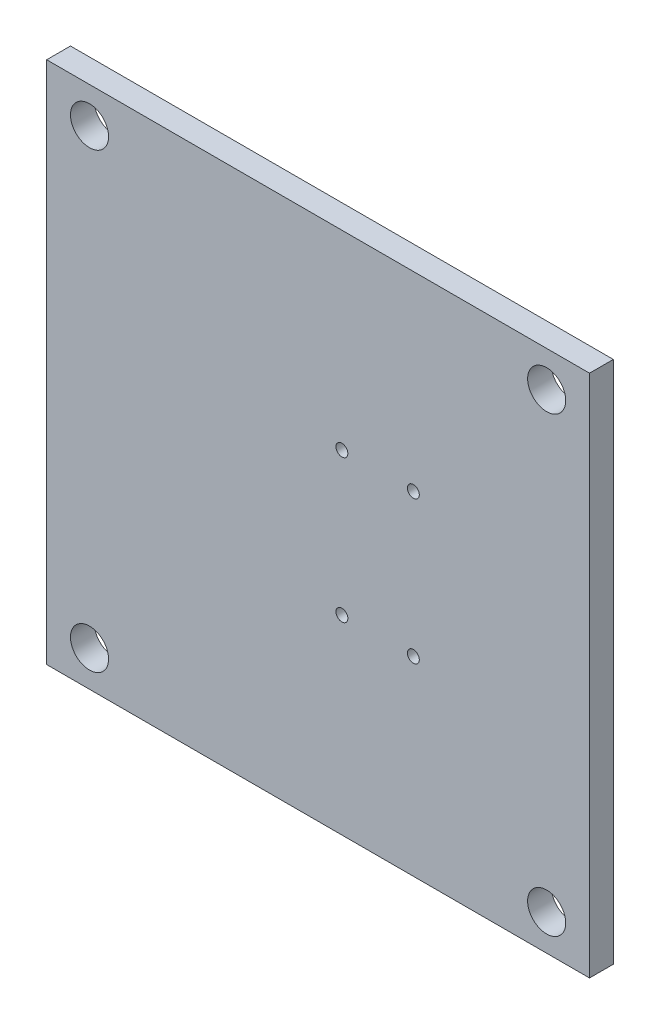
from build123d import *

# Parameters (mm, degrees)
SKETCH_1_W               = 114
SKETCH_1_H               = 110
EXTRUDE_2_DEPTH          = 2.5
SKETCH_2_R               = 4
CUT_EXTRUDE_1_DEPTH      = 80.366239674
MIRROR_2_COPY_1_SKETCH_R = 4
MIRROR_2_COPY_1_DEPTH    = 80.366239674
HOLE_WIZARD_M3_1_D       = 2.5


with BuildPart() as part:
    # 草图1 → 凸台-拉伸2 (new, symmetric)
    with BuildSketch(Plane.XY):
        Rectangle(SKETCH_1_W, SKETCH_1_H)
    extrude(amount=EXTRUDE_2_DEPTH, both=True)

    # 草图2 → 切除-拉伸1 (cut, through all)
    with BuildSketch(Plane.XY.offset(2.5)):
        with Locations((-48, 47.5)):
            Circle(SKETCH_2_R)
    cut_extrude_1 = extrude(amount=-CUT_EXTRUDE_1_DEPTH, mode=Mode.SUBTRACT)

    # 镜向1: 切除-拉伸1 across plane
    add(cut_extrude_1.mirror(Plane.ZX), mode=Mode.SUBTRACT)

    # 镜向2: 切除-拉伸1 across plane
    add(cut_extrude_1.mirror(Plane(origin=(0, 0, 0), x_dir=(0, 0, 1), z_dir=(1, 0, 0))), mode=Mode.SUBTRACT)

    # 镜向2 copy 1 sketch → 镜向2 copy 1 (cut, through all)
    with BuildSketch(Plane(origin=(0, 0, 2.5), x_dir=(-1, 0, 0), z_dir=(0, 0, 1))):
        with Locations((-48, 47.5)):
            Circle(MIRROR_2_COPY_1_SKETCH_R)
    extrude(amount=-MIRROR_2_COPY_1_DEPTH, mode=Mode.SUBTRACT)

    # M3 螺纹孔的螺纹孔钻头1 (through all)
    with Locations(Plane(origin=(5, 15, 2.5), x_dir=(1, 0, 0), z_dir=(0, 0, 1))):
        with Locations((0, 0), (15, 0)):
            hole_wizard_m3_1 = Hole(HOLE_WIZARD_M3_1_D / 2)

    # 镜向3: M3 螺纹孔的螺纹孔钻头1 across plane
    add(hole_wizard_m3_1.mirror(Plane.ZX), mode=Mode.SUBTRACT)


solid = part.part
